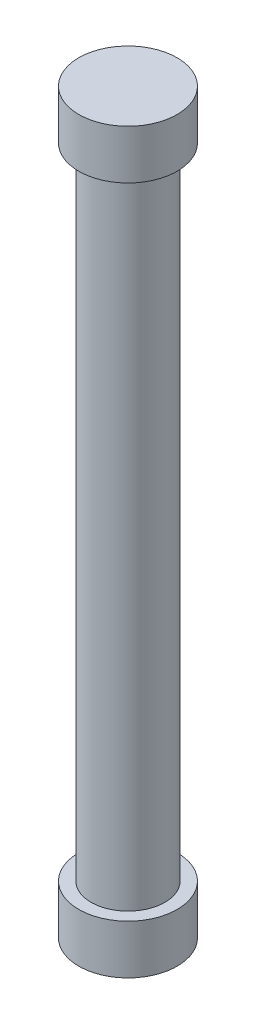
from build123d import *


with BuildPart() as part:
    # Sketch1 → Revolve1 (revolve)
    with BuildSketch(Plane.XY):
        Polygon((0, 19.89), (0, -10.11), (-2, -10.11), (-2, -8.11), (-1.5, -8.11), (-1.5, 17.89), (-2, 17.89), (-2, 19.89), align=None)
    revolve(axis=Axis((0, 19.89, 0), (0, -1, 0)))


solid = part.part
